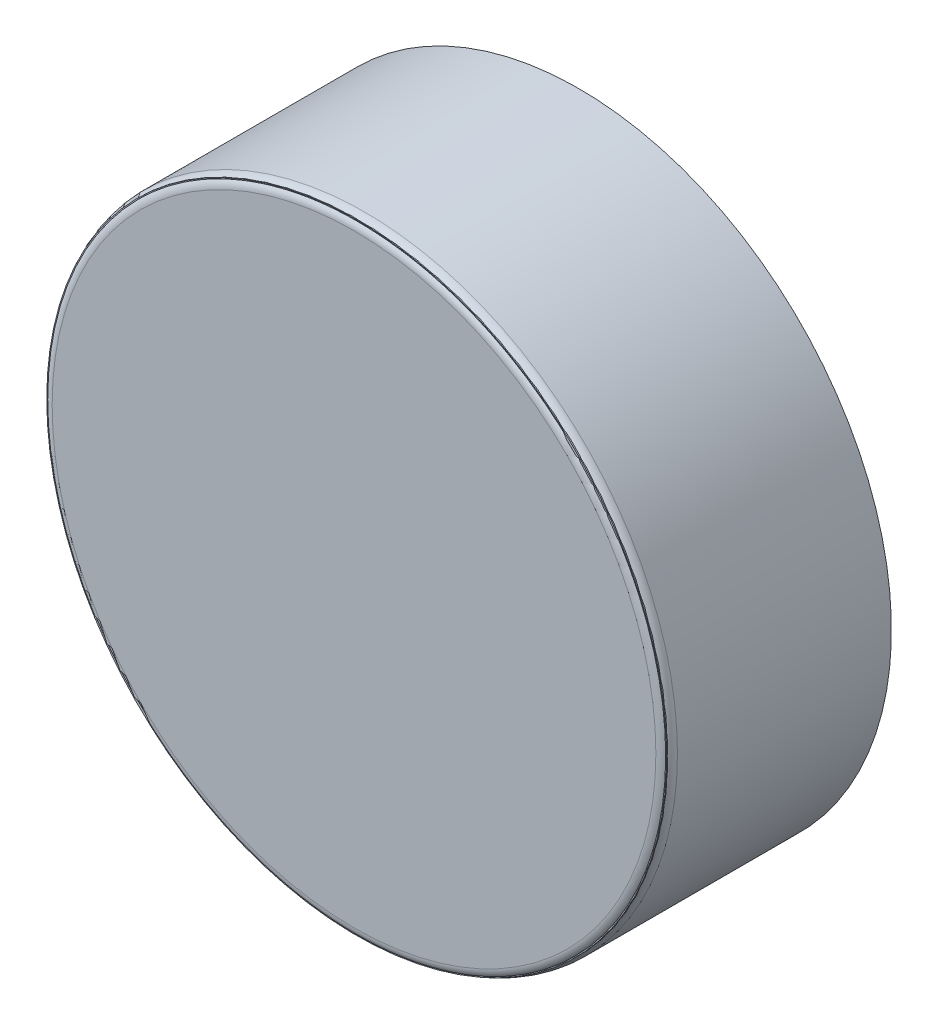
from build123d import *

# Parameters (mm, degrees)
SKETCH1_R           = 73.66
BOSS_EXTRUDE1_DEPTH = 0.635
BOSS_EXTRUDE2_START = 52.324
SKETCH2_R           = 73.66
SKETCH2_R_2         = 73.025
BOSS_EXTRUDE2_DEPTH = 52.324
FILLET1_R           = 2.54


with BuildPart() as part:
    # Sketch1 → Boss-Extrude1 (new body)
    with BuildSketch(Plane.XY):
        Circle(SKETCH1_R)
    extrude(amount=BOSS_EXTRUDE1_DEPTH)

    # Sketch2 → Boss-Extrude2 (add)
    with BuildSketch(Plane(origin=(0, 0, 0), x_dir=(-1, 0, 0), z_dir=(0, 0, -1)).offset(BOSS_EXTRUDE2_START)):
        Circle(SKETCH2_R)
        Circle(SKETCH2_R_2, mode=Mode.SUBTRACT)
    extrude(amount=-BOSS_EXTRUDE2_DEPTH)

    # Fillet1
    fillet1_edges = [part.edges().sort_by_distance(p)[0] for p in [
        (-73.66, 0, 0.635),
    ]]
    fillet(fillet1_edges, radius=FILLET1_R)


solid = part.part
